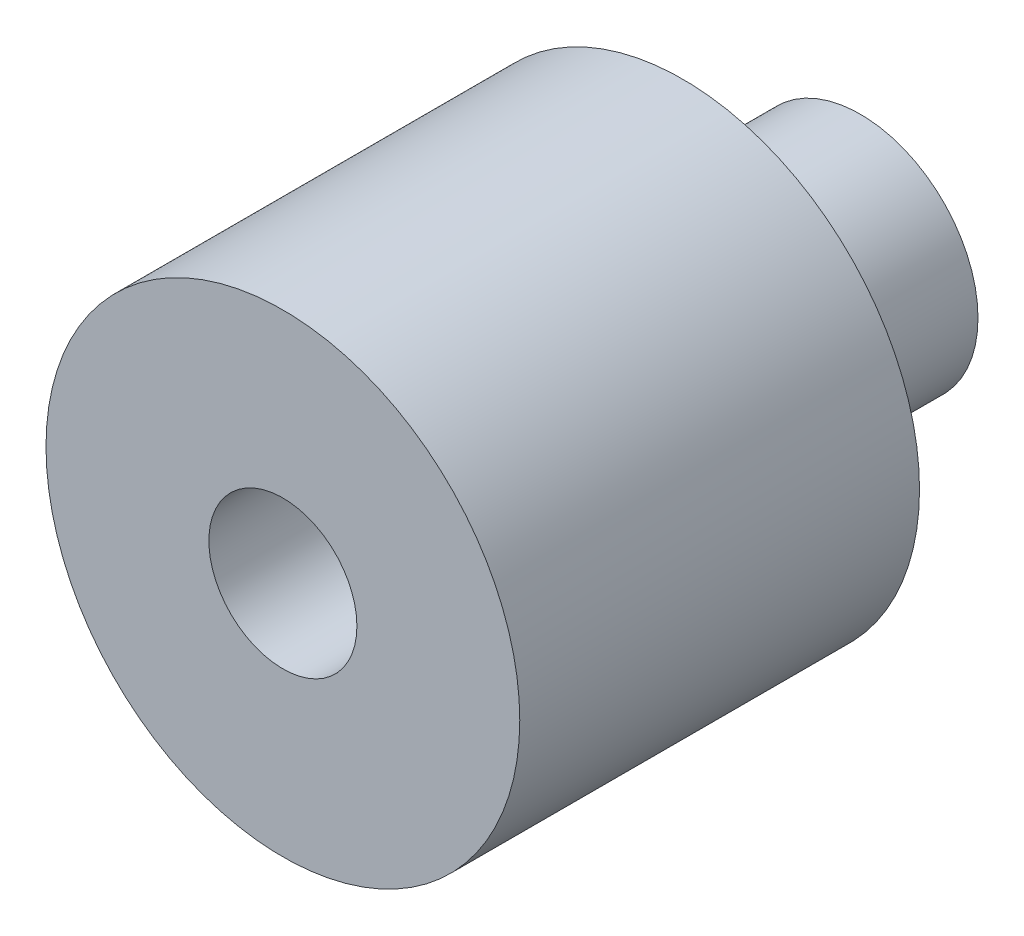
from build123d import *

# Parameters (mm, degrees)
SKETCH1_R           = 8
BOSS_EXTRUDE1_DEPTH = 13.5
SKETCH3_R           = 3.975
BOSS_EXTRUDE2_DEPTH = 6
SKETCH4_R           = 2.5
CUT_EXTRUDE2_DEPTH  = 13
SKETCH7_R           = 2
CUT_EXTRUDE3_DEPTH  = 5


with BuildPart() as part:
    # Sketch1 → Boss-Extrude1 (new body)
    with BuildSketch(Plane.XY):
        Circle(SKETCH1_R)
    extrude(amount=BOSS_EXTRUDE1_DEPTH)

    # Sketch3 → Boss-Extrude2 (add)
    with BuildSketch(Plane(origin=(0, 0, 0), x_dir=(-1, 0, 0), z_dir=(0, 0, -1))):
        Circle(SKETCH3_R)
    extrude(amount=BOSS_EXTRUDE2_DEPTH)

    # Sketch4 → Cut-Extrude2 (cut)
    with BuildSketch(Plane.XY.offset(13.5)):
        Circle(SKETCH4_R)
    extrude(amount=-CUT_EXTRUDE2_DEPTH, mode=Mode.SUBTRACT)

    # Sketch7 → Cut-Extrude3 (cut)
    with BuildSketch(Plane(origin=(0, 0, -6), x_dir=(-1, 0, 0), z_dir=(0, 0, -1))):
        Circle(SKETCH7_R)
    extrude(amount=-CUT_EXTRUDE3_DEPTH, mode=Mode.SUBTRACT)


solid = part.part
